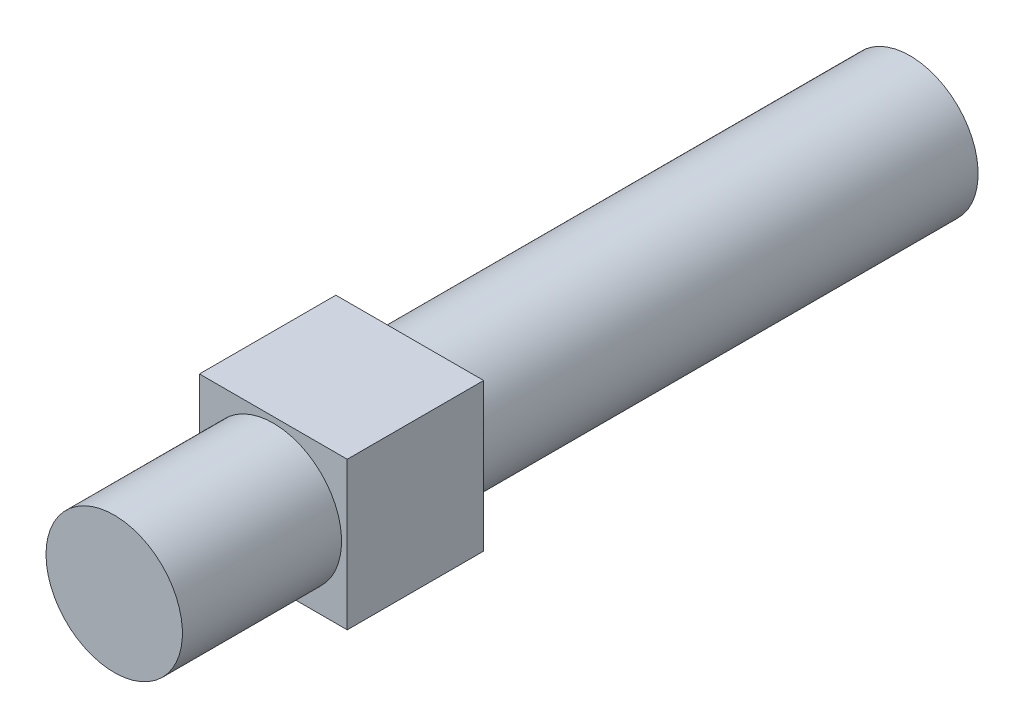
from build123d import *

# Parameters (mm, degrees)
SKETCH1_W           = 6
SKETCH1_H           = 70
SKETCH2_W           = 13
SKETCH2_H           = 13
BOSS_EXTRUDE1_DEPTH = 12


with BuildPart() as part:
    # Sketch1 → Revolve1 (revolve)
    with BuildSketch(Plane(origin=(0, 0, 0), x_dir=(1, 0, 0), z_dir=(0, 1, 0)), mode=Mode.PRIVATE) as revolve1_sk:
        with Locations((3, 35)):
            Rectangle(SKETCH1_W, SKETCH1_H)
    revolve(revolve1_sk.sketch.rotate(Axis((0, 0, -75.213634587), (0, 0, 1)), 180), axis=Axis((0, 0, -75.213634587), (0, 0, 1)))

    # Sketch2 → Boss-Extrude1 (add)
    with BuildSketch(Plane.XY.offset(-14)):
        Rectangle(SKETCH2_W, SKETCH2_H)
    extrude(amount=-BOSS_EXTRUDE1_DEPTH)


solid = part.part
